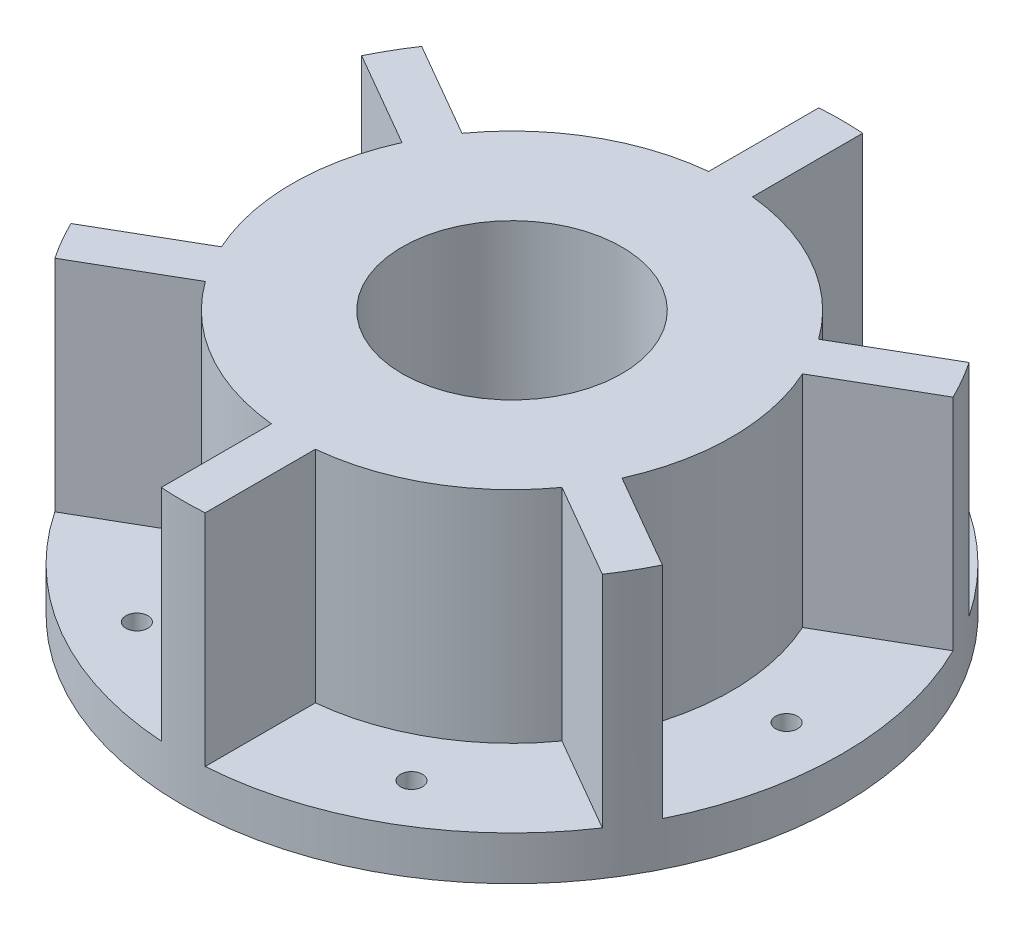
from build123d import *

# Parameters (mm, degrees)
SKETCH1_R           = 75
BOSS_EXTRUDE1_DEPTH = 10
SKETCH2_R           = 50
SKETCH2_R_2         = 25
BOSS_EXTRUDE2_DEPTH = 50
BOSS_EXTRUDE4_DEPTH = 50
CIRPATTERN2_COUNT   = 6
SKETCH5_R           = 2.5
CUT_EXTRUDE5_DEPTH  = 5
CIRPATTERN3_COUNT   = 6


with BuildPart() as part:
    # Sketch1 → Boss-Extrude1 (new body)
    with BuildSketch(Plane(origin=(0, 0, 0), x_dir=(1, 0, 0), z_dir=(0, 1, 0))):
        with Locations(Location((0, 0, 0), (0, 0, 270))):
            Circle(SKETCH1_R)
    extrude(amount=BOSS_EXTRUDE1_DEPTH)

    # Sketch2 → Boss-Extrude2 (add)
    with BuildSketch(Plane(origin=(0, 10, 0), x_dir=(1, 0, 0), z_dir=(0, 1, 0))):
        with Locations(Location((0, 0, 0), (0, 0, 270))):
            Circle(SKETCH2_R)
        with Locations(Location((0, 0, 0), (0, 0, 270))):
            Circle(SKETCH2_R_2, mode=Mode.SUBTRACT)
    extrude(amount=BOSS_EXTRUDE2_DEPTH)

    # Sketch3 → Boss-Extrude4 (add)
    with BuildSketch(Plane(origin=(0, 10, 0), x_dir=(1, 0, 0), z_dir=(0, 1, 0))):
        with BuildLine():
            ThreePointArc((5, 74.833147735), (0, 75), (-5, 74.833147735))
            Line((-5, 74.833147735), (-5, 49.749371855))
            ThreePointArc((-5, 49.749371855), (0, 50), (5, 49.749371855))
            Line((5, 49.749371855), (5, 74.833147735))
        make_face()
        with BuildLine():
            Line((5, -74.833147735), (5, -49.749371855))
            ThreePointArc((5, -49.749371855), (0, -50), (-5, -49.749371855))
            Line((-5, -49.749371855), (-5, -74.833147735))
            ThreePointArc((-5, -74.833147735), (0, -75), (5, -74.833147735))
        make_face()
    boss_extrude4 = extrude(amount=BOSS_EXTRUDE4_DEPTH)

    # CirPattern2: Boss-Extrude4 ×6 about axis
    cirpattern2_axis = Axis((0, 0, 0), (0, 1, 0))
    for i in range(1, CIRPATTERN2_COUNT):
        add(boss_extrude4.rotate(cirpattern2_axis, i * 360 / CIRPATTERN2_COUNT))

    # Sketch5 → Cut-Extrude5 (cut)
    with BuildSketch(Plane(origin=(0, 10, 0), x_dir=(1, 0, 0), z_dir=(0, 1, 0))):
        with Locations(Location((-62.5, 0, 0), (0, 0, 270))):
            Circle(SKETCH5_R)
    cut_extrude5 = extrude(amount=-CUT_EXTRUDE5_DEPTH, mode=Mode.SUBTRACT)

    # CirPattern3: Cut-Extrude5 ×6 about axis
    cirpattern3_axis = Axis((0, 0, 0), (0, 1, 0))
    for i in range(1, CIRPATTERN3_COUNT):
        add(cut_extrude5.rotate(cirpattern3_axis, i * 360 / CIRPATTERN3_COUNT), mode=Mode.SUBTRACT)


solid = part.part
